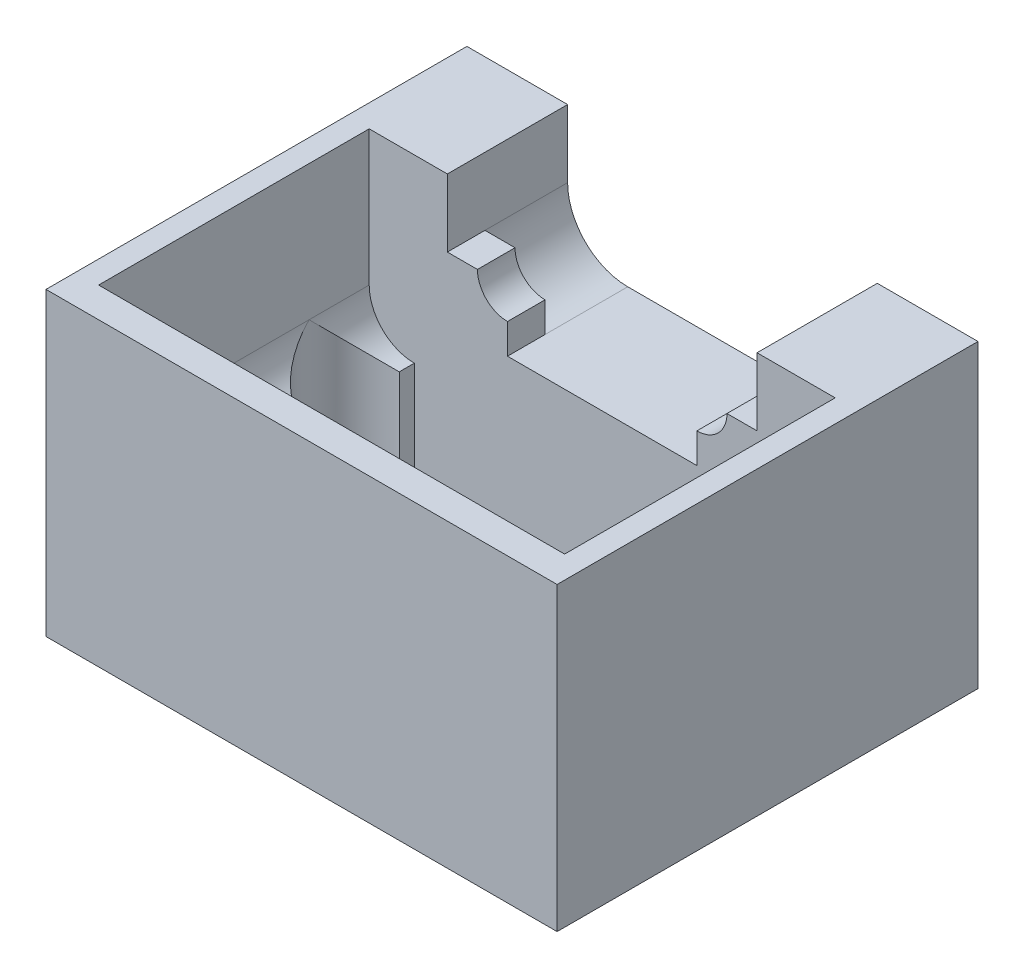
from build123d import *

# Parameters (mm, degrees)
SKETCH2_W           = 34
SKETCH2_H           = 28
BOSS_EXTRUDE1_DEPTH = 20
CUT_EXTRUDE1_DEPTH  = 18
SKETCH4_W           = 31
SKETCH4_H           = 18
CUT_EXTRUDE2_DEPTH  = 9
CUT_EXTRUDE3_REACH  = 38.946
SKETCH5_R           = 3
SKETCH8_W           = 12.6
SKETCH8_H           = 8
CUT_EXTRUDE5_DEPTH  = 8.5
SKETCH11_W          = 20.6
SKETCH11_H          = 8
CUT_EXTRUDE6_DEPTH  = 4.5


with BuildPart() as part:
    # Sketch2 → Boss-Extrude1 (new body)
    with BuildSketch(Plane(origin=(0, 0, 0), x_dir=(1, 0, 0), z_dir=(0, 1, 0))):
        Rectangle(SKETCH2_W, SKETCH2_H)
    extrude(amount=BOSS_EXTRUDE1_DEPTH)

    # Sketch3 → Cut-Extrude1 (cut)
    with BuildSketch(Plane(origin=(0, 20, 0), x_dir=(1, 0, 0), z_dir=(0, 1, 0))):
        with BuildLine():
            Line((-12.5, 6), (-12.5, 5))
            ThreePointArc((-12.5, 5), (-15.5, 2), (-12.5, -1))
            Line((-12.5, -1), (-12.5, -12))
            Line((-12.5, -12), (12.5, -12))
            Line((12.5, -12), (12.5, -1))
            ThreePointArc((12.5, -1), (15.5, 2), (12.5, 5))
            Line((12.5, 5), (12.5, 6))
            Line((12.5, 6), (-12.5, 6))
        make_face()
    extrude(amount=-CUT_EXTRUDE1_DEPTH, mode=Mode.SUBTRACT)

    # Sketch4 → Cut-Extrude2 (cut)
    with BuildSketch(Plane(origin=(0, 20, 0), x_dir=(1, 0, 0), z_dir=(0, 1, 0))):
        with Locations((0, -3)):
            Rectangle(SKETCH4_W, SKETCH4_H)
    extrude(amount=-CUT_EXTRUDE2_DEPTH, mode=Mode.SUBTRACT)

    # Cut-Extrude3: up to this face of the body (flat: up to its plane)
    cut_extrude3_end = Plane(part.part.faces().sort_by_distance((0, 11.482142857, -6))[0])
    # Sketch5 → Cut-Extrude3 (cut, up to the picked face)
    with BuildSketch(Plane(origin=(0, 0, 12), x_dir=(-1, 0, 0), z_dir=(0, 0, -1)), mode=Mode.PRIVATE) as cut_extrude3_sk1:
        with Locations((12.5, 11)):
            Circle(SKETCH5_R)
    cut_extrude3_tool1 = split(extrude(cut_extrude3_sk1.sketch, amount=CUT_EXTRUDE3_REACH, mode=Mode.PRIVATE), bisect_by=cut_extrude3_end, keep=Keep.BOTH, mode=Mode.PRIVATE)
    # Sketch5 → Cut-Extrude3 (cut, up to the picked face)
    with BuildSketch(Plane(origin=(0, 0, 12), x_dir=(-1, 0, 0), z_dir=(0, 0, -1)), mode=Mode.PRIVATE) as cut_extrude3_sk2:
        with Locations((-12.5, 11)):
            Circle(SKETCH5_R)
    cut_extrude3_tool2 = split(extrude(cut_extrude3_sk2.sketch, amount=CUT_EXTRUDE3_REACH, mode=Mode.PRIVATE), bisect_by=cut_extrude3_end, keep=Keep.BOTH, mode=Mode.PRIVATE)
    add(cut_extrude3_tool1.solids().sort_by(Axis((-12.5, 11, 12), (0, 0, -1)))[0], mode=Mode.SUBTRACT)
    add(cut_extrude3_tool2.solids().sort_by(Axis((12.5, 11, 12), (0, 0, -1)))[0], mode=Mode.SUBTRACT)

    # Sketch8 → Cut-Extrude5 (cut)
    with BuildSketch(Plane(origin=(0, 20, 0), x_dir=(1, 0, 0), z_dir=(0, 1, 0))):
        with Locations((0, 10)):
            Rectangle(SKETCH8_W, SKETCH8_H)
    extrude(amount=-CUT_EXTRUDE5_DEPTH, mode=Mode.SUBTRACT)

    # Sketch10 → Cut-Revolve1 (revolve, cut)
    with BuildSketch(Plane(origin=(-6.3, 0, 0), x_dir=(0, 0, -1), z_dir=(1, 0, 0))):
        Polygon((6, 15.5), (14, 15.5), (14, 19.5), (8.5, 19.5), (8.5, 17.5), (6, 17.5), align=None)
    cut_revolve1 = revolve(axis=Axis((-6.3, 15.5, -6), (0, 0, -1)), mode=Mode.SUBTRACT)

    # Mirror1: Cut-Revolve1 across plane
    add(cut_revolve1.mirror(Plane(origin=(0, 0, 0), x_dir=(0, 0, 1), z_dir=(1, 0, 0))), mode=Mode.SUBTRACT)

    # Sketch11 → Cut-Extrude6 (cut)
    with BuildSketch(Plane(origin=(0, 20, 0), x_dir=(1, 0, 0), z_dir=(0, 1, 0))):
        with Locations((0, 10)):
            Rectangle(SKETCH11_W, SKETCH11_H)
    extrude(amount=-CUT_EXTRUDE6_DEPTH, mode=Mode.SUBTRACT)


solid = part.part
